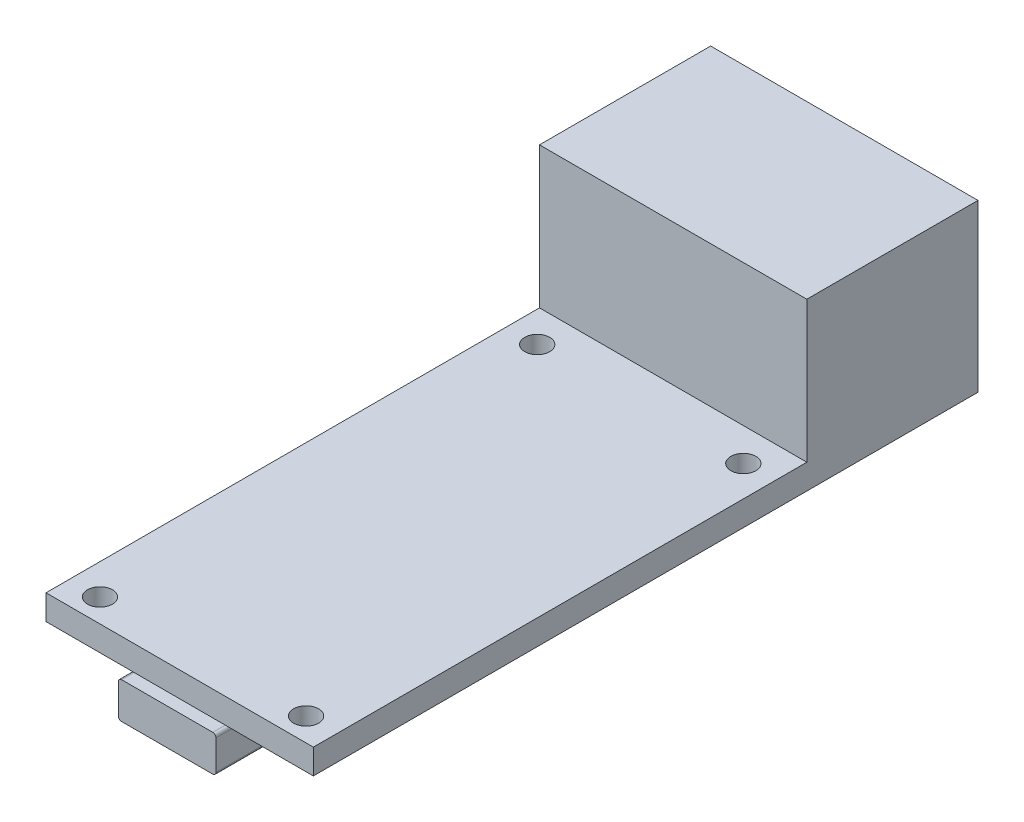
from build123d import *

# Parameters (mm, degrees)
SKETCH1_W             = 21.4
SKETCH1_H             = 53.2
BOSS_EXTRUDE1_DEPTH   = 2
SKETCH2_W             = 21.4
SKETCH2_H             = 13.7
BOSS_EXTRUDE2_DEPTH   = 11.3
SKETCH3_R             = 3.65
CUT_EXTRUDE1_DEPTH    = 4
F_2_0MM_DOWEL_HOLE1_D = 2
BOSS_EXTRUDE3_DEPTH   = 1
BOSS_EXTRUDE4_DEPTH   = 5


with BuildPart() as part:
    # Sketch1 → Boss-Extrude1 (new body)
    with BuildSketch(Plane(origin=(0, 0, 0), x_dir=(1, 0, 0), z_dir=(0, 1, 0))):
        with Locations((10.7, 26.6)):
            Rectangle(SKETCH1_W, SKETCH1_H)
    extrude(amount=BOSS_EXTRUDE1_DEPTH)

    # Sketch2 → Boss-Extrude2 (add)
    with BuildSketch(Plane(origin=(0, 2, 0), x_dir=(1, 0, 0), z_dir=(0, 1, 0))):
        with Locations((10.7, 46.35)):
            Rectangle(SKETCH2_W, SKETCH2_H)
    extrude(amount=BOSS_EXTRUDE2_DEPTH)

    # Sketch3 → Cut-Extrude1 (cut)
    with BuildSketch(Plane(origin=(0, 0, -53.2), x_dir=(-1, 0, 0), z_dir=(0, 0, -1))):
        with Locations((-10.7, 7.65)):
            Circle(SKETCH3_R)
    extrude(amount=-CUT_EXTRUDE1_DEPTH, mode=Mode.SUBTRACT)

    # Ø2.0mm Dowel Hole1 (through all)
    with Locations(Plane(origin=(0, 2, 0), x_dir=(1, 0, 0), z_dir=(0, 1, 0))):
        with Locations((2.45, 36.869115366), (18.95, 36.869115366), (18.95, 1.869115366), (2.45, 1.869115366)):
            Hole(F_2_0MM_DOWEL_HOLE1_D / 2)



with BuildPart() as body_2:
    # Sketch10 → Boss-Extrude3 (new body)
    with BuildSketch(Plane.XY):
        with BuildLine():
            Line((7.05, 0), (14.35, 0))
            ThreePointArc((14.35, 0), (14.526776695, -0.073223305), (14.6, -0.25))
            Line((14.6, -0.25), (14.6, -2.65))
            ThreePointArc((14.6, -2.65), (14.526776695, -2.826776695), (14.35, -2.9))
            Line((14.35, -2.9), (7.05, -2.9))
            ThreePointArc((7.05, -2.9), (6.873223305, -2.826776695), (6.8, -2.65))
            Line((6.8, -2.65), (6.8, -0.25))
            ThreePointArc((6.8, -0.25), (6.873223305, -0.073223305), (7.05, 0))
        make_face()
    extrude(amount=BOSS_EXTRUDE3_DEPTH)


with BuildPart() as part_1:
    add(part.part)

    add(body_2.part)  # Boss-Extrude4 merges body 2
    # Sketch10<2> → Boss-Extrude4 (add)
    with BuildSketch(Plane.XY):
        with BuildLine():
            Line((7.05, 0), (14.35, 0))
            ThreePointArc((14.35, 0), (14.526776695, -0.073223305), (14.6, -0.25))
            Line((14.6, -0.25), (14.6, -2.65))
            ThreePointArc((14.6, -2.65), (14.526776695, -2.826776695), (14.35, -2.9))
            Line((14.35, -2.9), (7.05, -2.9))
            ThreePointArc((7.05, -2.9), (6.873223305, -2.826776695), (6.8, -2.65))
            Line((6.8, -2.65), (6.8, -0.25))
            ThreePointArc((6.8, -0.25), (6.873223305, -0.073223305), (7.05, 0))
        make_face()
    extrude(amount=-BOSS_EXTRUDE4_DEPTH)


solid = part_1.part
